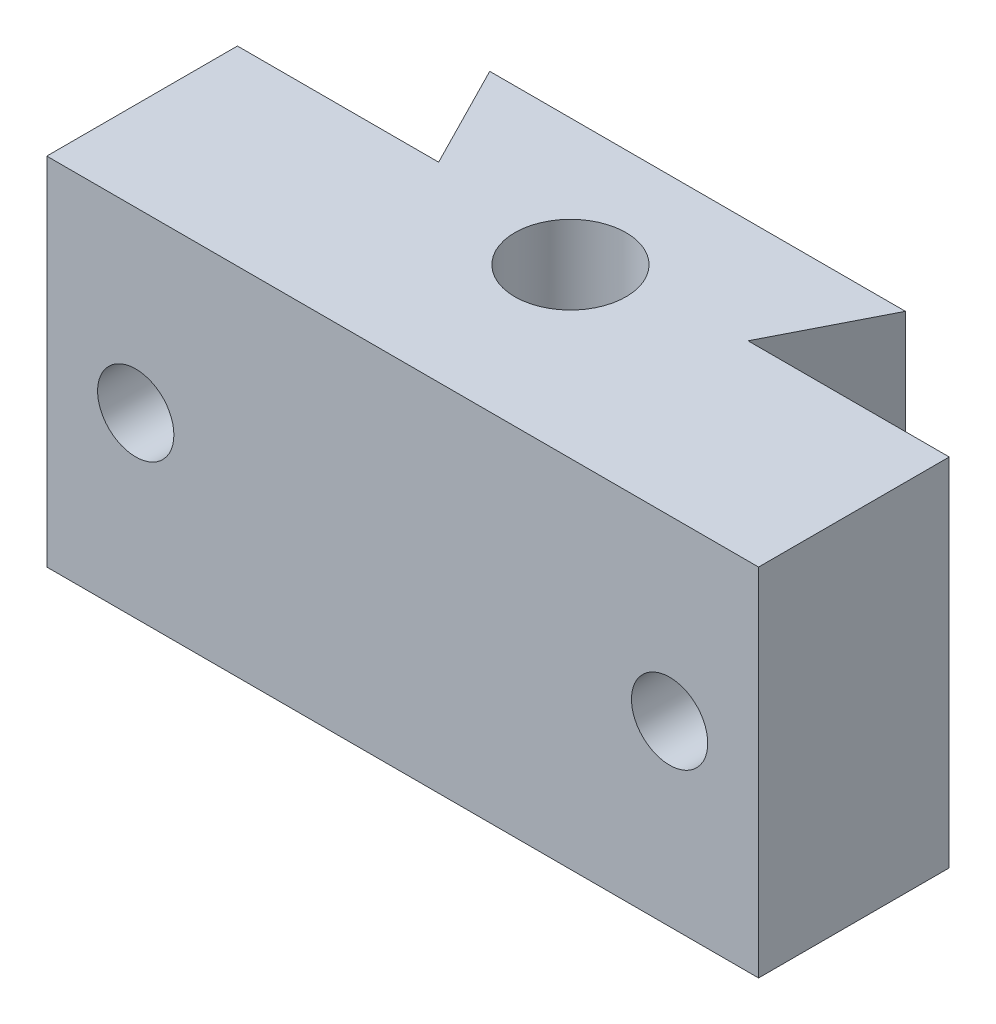
from build123d import *

# Parameters (mm, degrees)
SKETCH1_W           = 56
SKETCH1_H           = 15
BOSS_EXTRUDE1_DEPTH = 14
SKETCH2_R           = 4.375
CUT_EXTRUDE1_DEPTH  = 28
SKETCH4_R           = 3
CUT_EXTRUDE3_DEPTH  = 15
CUT_EXTRUDE4_DEPTH  = 3.375


with BuildPart() as part:
    # Sketch1 → Boss-Extrude1 (new, symmetric)
    with BuildSketch(Plane(origin=(0, 0, 0), x_dir=(1, 0, 0), z_dir=(0, 1, 0))):
        Polygon((-16.35, 15.7), (-12.171891314, 7.5), (12.171891314, 7.5), (16.35, 15.7), align=None)
        Rectangle(SKETCH1_W, SKETCH1_H)
    extrude(amount=BOSS_EXTRUDE1_DEPTH, both=True)

    # Sketch2 → Cut-Extrude1 (cut)
    with BuildSketch(Plane(origin=(0, 14, 0), x_dir=(1, 0, 0), z_dir=(0, 1, 0))):
        with Locations(Location((0, 5.7, 0), (0, 0, 270))):
            Circle(SKETCH2_R)
    extrude(amount=-CUT_EXTRUDE1_DEPTH, mode=Mode.SUBTRACT)

    # Sketch4 → Cut-Extrude3 (cut)
    with BuildSketch(Plane.XY.offset(7.5)):
        with Locations((-21, 0)):
            Circle(SKETCH4_R)
        with Locations((21, 0)):
            Circle(SKETCH4_R)
    extrude(amount=-CUT_EXTRUDE3_DEPTH, mode=Mode.SUBTRACT)

    # Sketch3 → Cut-Extrude4 (cut, symmetric)
    with BuildSketch(Plane.XZ):
        Polygon((7.505553499, -5.7), (7.505553499, -15.7), (-7.505553499, -15.7), (-7.505553499, -5.7), (-3.75277675, 0.8), (3.75277675, 0.8), align=None)
    extrude(amount=CUT_EXTRUDE4_DEPTH, both=True, mode=Mode.SUBTRACT)


solid = part.part
